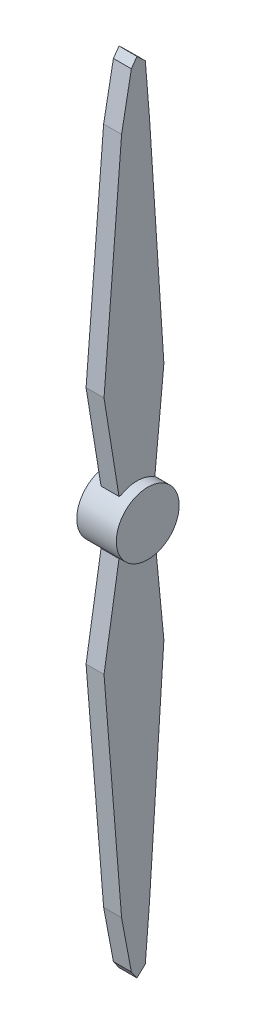
from build123d import *

# Parameters (mm, degrees)
BOSS_EXTRUDE1_DEPTH   = 4
BOSS_EXTRUDE1_2_DEPTH = 4
SKETCH2_R             = 14
BOSS_EXTRUDE2_DEPTH   = 8.8


with BuildPart() as part:
    # Sketch1 → Boss-Extrude1 (new, symmetric)
    with BuildSketch(Plane(origin=(0, 0, 0), x_dir=(0, 0, -1), z_dir=(1, 0, 0))):
        Polygon((-8.001, 12), (-14.6685, 53.34), (-6.8453, 151.13), (-2.4892, 174.244), (0, 177.8), (3.7338, 174.244), (5.6007, 151.13), (12.0015, 53.34), (8.001, 12), align=None)
    extrude(amount=BOSS_EXTRUDE1_DEPTH, both=True)



with BuildPart() as body_2:
    # Sketch1 → Boss-Extrude1 2 (new, symmetric)
    with BuildSketch(Plane(origin=(0, 0, 0), x_dir=(0, 0, -1), z_dir=(1, 0, 0))):
        Polygon((-8.001, -12), (-14.6685, -53.34), (-6.8453, -151.13), (-2.4892, -174.244), (0, -177.8), (3.7338, -174.244), (5.6007, -151.13), (12.0015, -53.34), (8.001, -12), align=None)
    extrude(amount=BOSS_EXTRUDE1_2_DEPTH, both=True)


with BuildPart() as part_1:
    add(part.part)

    add(body_2.part)  # Boss-Extrude2 merges body 2
    # Sketch2 → Boss-Extrude2 (add, symmetric)
    with BuildSketch(Plane(origin=(0, 0, 0), x_dir=(0, 0, -1), z_dir=(1, 0, 0))):
        Circle(SKETCH2_R)
    extrude(amount=BOSS_EXTRUDE2_DEPTH, both=True)


solid = part_1.part
